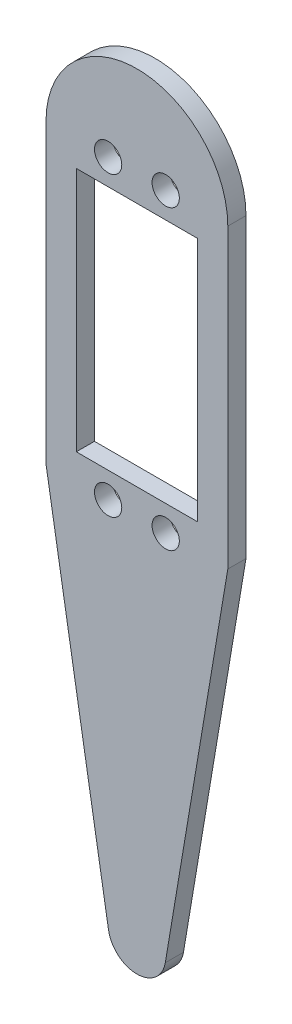
from build123d import *

# Parameters (mm, degrees)
SKETCH1_R           = 2.25
SKETCH1_W           = 20
SKETCH1_H           = 40.5
BOSS_EXTRUDE1_DEPTH = 3


with BuildPart() as part:
    # Sketch1 → Boss-Extrude1 (new body)
    with BuildSketch(Plane.XY):
        with BuildLine():
            Line((-5, 44.75), (-5, -4.25))
            Line((-5, -4.25), (5.31559474, -65.676668518))
            ThreePointArc((5.31559474, -65.676668518), (10, -69.64), (14.68440526, -65.676668518))
            Line((14.68440526, -65.676668518), (25, -4.25))
            Line((25, -4.25), (25, 44.75))
            ThreePointArc((25, 44.75), (10, 59.75), (-5, 44.75))
        make_face()
        with Locations((14.75, -4.25)):
            Circle(SKETCH1_R, mode=Mode.SUBTRACT)
        with Locations((5.25, -4.25)):
            Circle(SKETCH1_R, mode=Mode.SUBTRACT)
        with Locations((14.75, 44.75)):
            Circle(SKETCH1_R, mode=Mode.SUBTRACT)
        with Locations((5.25, 44.75)):
            Circle(SKETCH1_R, mode=Mode.SUBTRACT)
        with Locations((10, 20.25)):
            Rectangle(SKETCH1_W, SKETCH1_H, mode=Mode.SUBTRACT)
    extrude(amount=BOSS_EXTRUDE1_DEPTH)


solid = part.part
